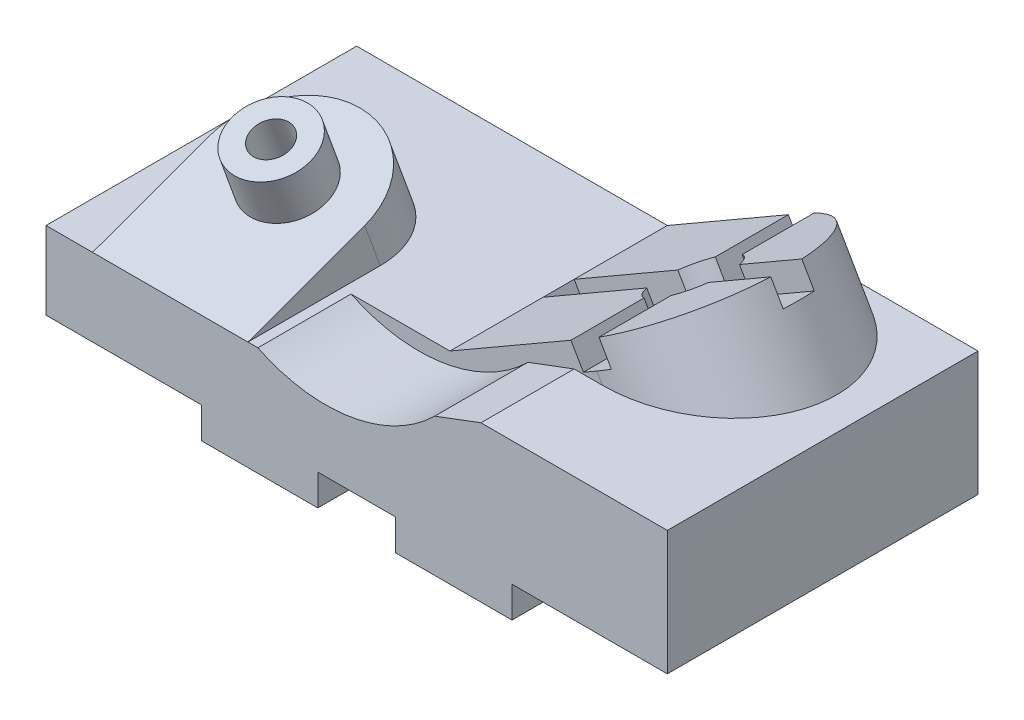
from build123d import *

# Parameters (mm, degrees)
BOSS_EXTRUDE3_DEPTH = 100
BOSS_EXTRUDE4_REACH = 226.87
SKETCH5_4_R         = 12.5
SKETCH5_4_R_2       = 6
BOSS_EXTRUDE5_DEPTH = 15
SKETCH7_R           = 6
CUT_EXTRUDE1_DEPTH  = 225.869761917
BOSS_EXTRUDE7_DEPTH = 35
CUT_EXTRUDE2_DEPTH  = 8
CUT_EXTRUDE3_DEPTH  = 30


with BuildPart() as part:
    # Sketch4 → Boss-Extrude3 (new body)
    with BuildSketch(Plane.XY):
        Polygon((0, 0), (50, 0), (50, -10), (87.5, -10), (87.5, 0), (112.5, 0), (112.5, -10), (150, -10), (150, 0), (200, 0), (200, 40), (140, 40), (100, 25), (0, 25), align=None)
    extrude(amount=BOSS_EXTRUDE3_DEPTH)

    # Boss-Extrude4: up to this face of the body (flat: up to its plane)
    boss_extrude4_end = Plane(part.part.faces().sort_by_distance((50, 25, 50))[0])
    # Sketch5 → Boss-Extrude4 (add, up to the picked face)
    with BuildSketch(Plane(origin=(0, 54.214936023, 19.732622965), x_dir=(-1, 0, 0), z_dir=(0, 0.9396926207859081, 0.34202014332566943)), mode=Mode.PRIVATE) as boss_extrude4_sk1:
        with BuildLine():
            Line((-15, 85.418758495), (-15, 45.418758495))
            ThreePointArc((-15, 45.418758495), (-40, 20.418758495), (-65, 45.418758495))
            Line((-65, 45.418758495), (-65, 85.418758495))
            Line((-65, 85.418758495), (-15, 85.418758495))
        make_face()
    boss_extrude4_tool1 = split(extrude(boss_extrude4_sk1.sketch, amount=-BOSS_EXTRUDE4_REACH, mode=Mode.PRIVATE), bisect_by=boss_extrude4_end, keep=Keep.BOTH, mode=Mode.PRIVATE)
    add(boss_extrude4_tool1.solids().sort_by(Axis((40, 35.287462, 71.735431), (0, -0.9396926207859081, -0.34202014332566943)))[0])

    # Sketch5<4> → Boss-Extrude5 (add)
    with BuildSketch(Plane(origin=(0, 54.214936023, 19.732622965), x_dir=(-1, 0, 0), z_dir=(0, 0.9396926207859081, 0.34202014332566943))):
        with Locations(Location((-40, 45.418758495, 0), (0, 0, 270))):
            Circle(SKETCH5_4_R)
        with Locations(Location((-40, 45.418758495, 0), (0, 0, 90))):
            Circle(SKETCH5_4_R_2, mode=Mode.SUBTRACT)
    extrude(amount=BOSS_EXTRUDE5_DEPTH)

    # Sketch7 → Cut-Extrude1 (cut, through all)
    with BuildSketch(Plane(origin=(0, 54.214936023, 19.732622965), x_dir=(1, 0, 0), z_dir=(0, 0.9396926207859082, 0.34202014332566943))):
        with Locations(Location((40, -45.418758495, 0), (0, 0, 270))):
            Circle(SKETCH7_R)
    extrude(amount=-CUT_EXTRUDE1_DEPTH, mode=Mode.SUBTRACT)

    # Sketch8 → Boss-Extrude7 (add)
    with BuildSketch(Plane(origin=(14.174682453, -24.551270189, 0), x_dir=(0, 0, -1), z_dir=(0.49999999999999506, -0.8660254037844415, 0))):
        with BuildLine():
            Line((0, 99.102540378), (0, 149.102540378))
            ThreePointArc((0, 149.102540378), (-35, 184.102540378), (-70, 149.102540378))
            Line((-70, 149.102540378), (-70, 99.102540378))
            Line((-70, 99.102540378), (0, 99.102540378))
        make_face()
    extrude(amount=BOSS_EXTRUDE7_DEPTH)

    # Sketch9 → Cut-Extrude2 (cut)
    with BuildSketch(Plane(origin=(14.174682453, -24.551270189, 0), x_dir=(0.8660254037844415, 0.4999999999999951, 0), z_dir=(-0.49999999999999517, 0.8660254037844416, 0))):
        with BuildLine():
            Line((99.102540378, -40), (137.646101141, -40))
            ThreePointArc((137.646101141, -40), (140.241070616, -43.816141653), (144.043854376, -46.430647223))
            Line((144.043854376, -46.430647223), (144.102540378, -70))
            Line((144.102540378, -70), (154.102540378, -70))
            Line((154.102540378, -70), (154.102540378, -46.456439237))
            ThreePointArc((154.102540378, -46.456439237), (157.941375143, -43.838834765), (160.558979616, -40))
            Line((160.558979616, -40), (184.102540378, -40))
            Line((184.102540378, -40), (184.102540378, -30))
            Line((184.102540378, -30), (160.558979616, -30))
            ThreePointArc((160.558979616, -30), (157.941375143, -26.161165235), (154.102540378, -23.543560763))
            Line((154.102540378, -23.543560763), (154.102540378, 0))
            Line((154.102540378, 0), (144.102540378, 0))
            Line((144.102540378, 0), (144.102540378, -23.543560763))
            ThreePointArc((144.102540378, -23.543560763), (140.263705614, -26.161165235), (137.646101141, -30))
            Line((137.646101141, -30), (99.102540378, -30))
            Line((99.102540378, -30), (99.102540378, -40))
        make_face()
    extrude(amount=-CUT_EXTRUDE2_DEPTH, mode=Mode.SUBTRACT)

    # Sketch10 → Cut-Extrude3 (cut)
    with BuildSketch(Plane.XY.offset(100)):
        with BuildLine():
            Line((66.16880238, 26.04463605), (66.16880238, 113.95536395))
            ThreePointArc((66.16880238, 113.95536395), (140, 70), (66.16880238, 26.04463605))
        make_face()
    extrude(amount=-CUT_EXTRUDE3_DEPTH, mode=Mode.SUBTRACT)


solid = part.part
